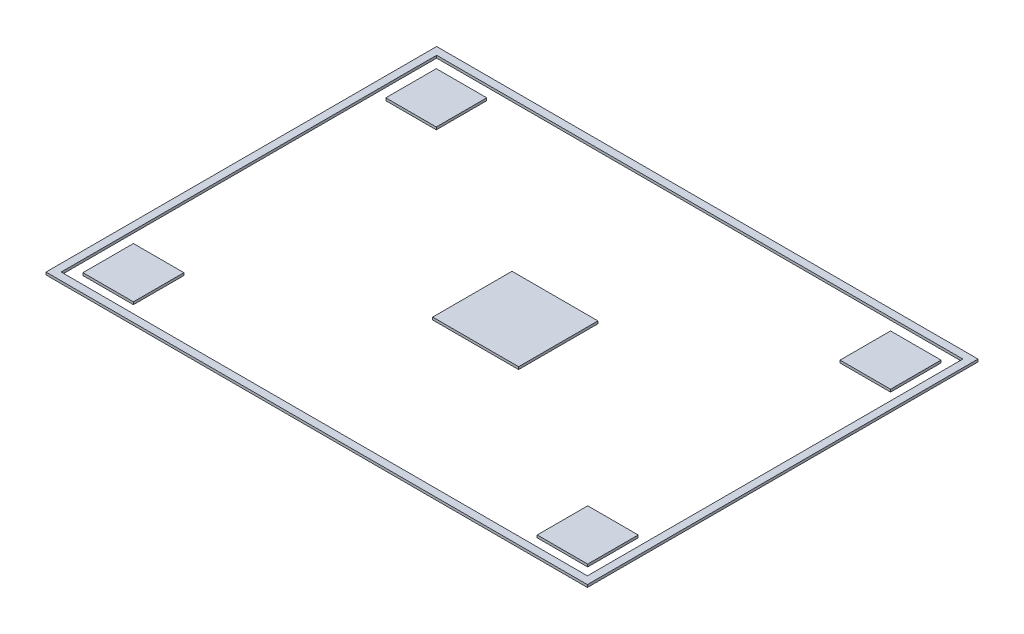
from build123d import *

# Parameters (mm, degrees)
SKETCH_1_W        = 214.500056991
SKETCH_1_H        = 154.77893514
SKETCH_1_W_2      = 208.500056991
SKETCH_1_H_2      = 148.77893514
EXTRUDE_1_DEPTH   = 1
SKETCH_1_W_3      = 20
SKETCH_1_H_3      = 20
EXTRUDE_1_2_DEPTH = 1
EXTRUDE_1_3_DEPTH = 1
SKETCH_1_W_4      = 34.051516846
SKETCH_1_H_4      = 31.432169396
EXTRUDE_1_4_DEPTH = 1
EXTRUDE_1_5_DEPTH = 1
EXTRUDE_1_6_DEPTH = 1


with BuildPart() as part:
    # 草图1 → 凸台-拉伸1 (new body)
    with BuildSketch(Plane(origin=(0, 0, 0), x_dir=(1, 0, 0), z_dir=(0, 1, 0))):
        with Locations((99.717581207, 50.2876223)):
            Rectangle(SKETCH_1_W, SKETCH_1_H)
        with Locations((99.717581207, 50.2876223)):
            Rectangle(SKETCH_1_W_2, SKETCH_1_H_2, mode=Mode.SUBTRACT)
    extrude(amount=EXTRUDE_1_DEPTH)


with BuildPart() as body_2:
    # 草图1 → Extrude 1 2 (new body)
    with BuildSketch(Plane(origin=(0, 0, 0), x_dir=(1, 0, 0), z_dir=(0, 1, 0))):
        with Locations((10, 110)):
            Rectangle(SKETCH_1_W_3, SKETCH_1_H_3)
    extrude(amount=EXTRUDE_1_2_DEPTH)


with BuildPart() as body_3:
    # 草图1 → Extrude 1 3 (new body)
    with BuildSketch(Plane(origin=(0, 0, 0), x_dir=(1, 0, 0), z_dir=(0, 1, 0))):
        with Locations((10, -10)):
            Rectangle(SKETCH_1_W_3, SKETCH_1_H_3)
    extrude(amount=EXTRUDE_1_3_DEPTH)


with BuildPart() as body_4:
    # 草图1 → Extrude 1 4 (new body)
    with BuildSketch(Plane(origin=(0, 0, 0), x_dir=(1, 0, 0), z_dir=(0, 1, 0))):
        with Locations((101.551124421, 49.76375281)):
            Rectangle(SKETCH_1_W_4, SKETCH_1_H_4)
    extrude(amount=EXTRUDE_1_4_DEPTH)


with BuildPart() as body_5:
    # 草图1 → Extrude 1 5 (new body)
    with BuildSketch(Plane(origin=(0, 0, 0), x_dir=(1, 0, 0), z_dir=(0, 1, 0))):
        with Locations((190, 110)):
            Rectangle(SKETCH_1_W_3, SKETCH_1_H_3)
    extrude(amount=EXTRUDE_1_5_DEPTH)


with BuildPart() as body_6:
    # 草图1 → Extrude 1 6 (new body)
    with BuildSketch(Plane(origin=(0, 0, 0), x_dir=(1, 0, 0), z_dir=(0, 1, 0))):
        with Locations((190, -10)):
            Rectangle(SKETCH_1_W_3, SKETCH_1_H_3)
    extrude(amount=EXTRUDE_1_6_DEPTH)


solid = Compound([part.part, body_2.part, body_3.part, body_4.part, body_5.part, body_6.part])
